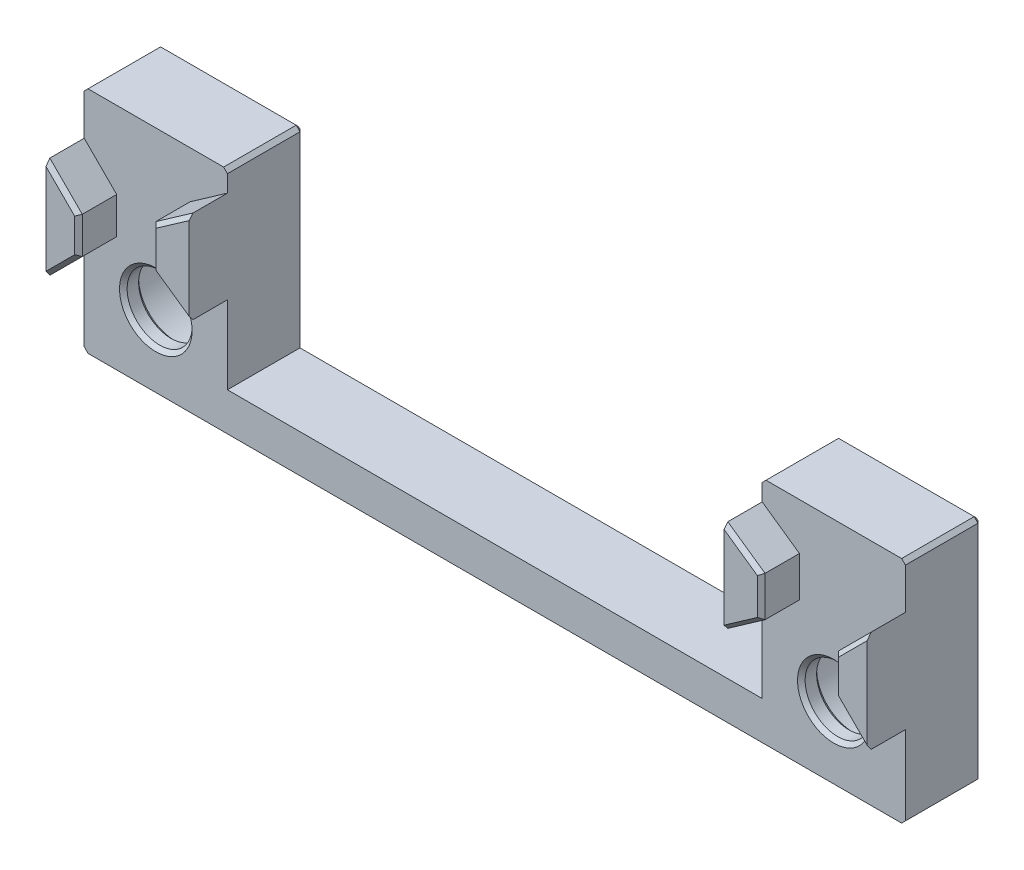
from build123d import *

# Parameters (mm, degrees)
BOSS_EXTRUDE1_DEPTH            = 4
SLOT_ALIGNER_DEPTH             = 2
ALIGNER_DEPTH                  = 2
DEBURS_SIZE                    = 0.2
CBORE_FOR_M3_SHCS1_D           = 3.4
CBORE_FOR_M3_SHCS1_CBORE_D     = 6.5
CBORE_FOR_M3_SHCS1_CBORE_DEPTH = 3
CHAMFER1_SIZE                  = 0.2


with BuildPart() as part:
    # Sketch1 → Boss-Extrude1 (new body)
    with BuildSketch(Plane.XY):
        Polygon((-21.3, -6), (21.3, -6), (21.5, -5.8), (21.5, 5.8), (21.3, 6), (14.2, 6), (14, 5.8), (14, -4), (-14, -4), (-14, 5.8), (-14.2, 6), (-21.3, 6), (-21.5, 5.8), (-21.5, -5.8), align=None)
    extrude(amount=-BOSS_EXTRUDE1_DEPTH)

    # Sketch3 → Slot Aligner (add)
    with BuildSketch(Plane.XY):
        Polygon((15.95, 3.552468642), (14, 4.917873342), (14, 0.082126658), (15.95, 1.447531358), align=None)
    slot_aligner = extrude(amount=SLOT_ALIGNER_DEPTH)

    # Mirror3: Slot Aligner across plane
    add(slot_aligner.mirror(Plane(origin=(0, 0, 0), x_dir=(0, 0, 1), z_dir=(1, 0, 0))))

    # Sketch4 → Aligner (add)
    with BuildSketch(Plane(origin=(0, 0, 0), x_dir=(-1, 0, 0), z_dir=(0, 0, -1))):
        Polygon((-19.8, 1.958578644), (-21.4, 3.558578644), (-21.5, 3.658578644), (-21.5, -1.658578644), (-21.4, -1.558578644), (-19.8, 0.041421356), align=None)
    aligner = extrude(amount=-ALIGNER_DEPTH)

    # Aligners: Aligner across plane
    add(aligner.mirror(Plane(origin=(0, 0, 0), x_dir=(0, 0, 1), z_dir=(1, 0, 0))))

    # Deburs
    deburs_edges = [part.edges().sort_by_distance(p)[0] for p in [
        (-14.1, 5.9, -4),
        (-17.75, 6, -4),
        (-21.4, 5.9, -4),
        (-21.5, 0, -4),
        (-21.4, -5.9, -4),
        (0, -6, -4),
        (21.4, -5.9, -4),
        (21.5, 0, -4),
        (21.4, 5.9, -4),
        (15.95, 2.5, 2),
        (14.975, 4.235170992, 2),
        (14.975, 0.764829008, 2),
        (17.75, 6, -4),
        (0, -4, -4),
        (14.1, 5.9, -4),
        (14, 0.9, -4),
        (-15.95, 2.5, 2),
        (-14.975, 0.764829008, 2),
        (-14.975, 4.235170992, 2),
        (19.8, 1, 2),
        (20.65, -0.808578644, 2),
        (20.65, 2.808578644, 2),
        (-19.8, 1, 2),
        (-20.65, 2.808578644, 2),
        (-20.65, -0.808578644, 2),
        (-14, 0.9, -4),
    ]]
    chamfer(deburs_edges, length=DEBURS_SIZE)

    # CBORE for M3 SHCS1 (through all)
    with Locations(Plane(origin=(0, 0, -4), x_dir=(-1, 0, 0), z_dir=(0, 0, -1))):
        with Locations((-17.75, -2.25), (17.75, -2.25)):
            CounterBoreHole(CBORE_FOR_M3_SHCS1_D / 2, CBORE_FOR_M3_SHCS1_CBORE_D / 2, CBORE_FOR_M3_SHCS1_CBORE_DEPTH)

    # Chamfer1
    chamfer1_edges = [part.edges().sort_by_distance(p)[0] for p in [
        (-19.45, -2.25, 0),
        (-14.5, -2.25, -4),
        (-19.45, -2.25, -1),
        (16.05, -2.25, 0),
        (21, -2.25, -4),
        (16.05, -2.25, -1),
    ]]
    chamfer(chamfer1_edges, length=CHAMFER1_SIZE)


solid = part.part
